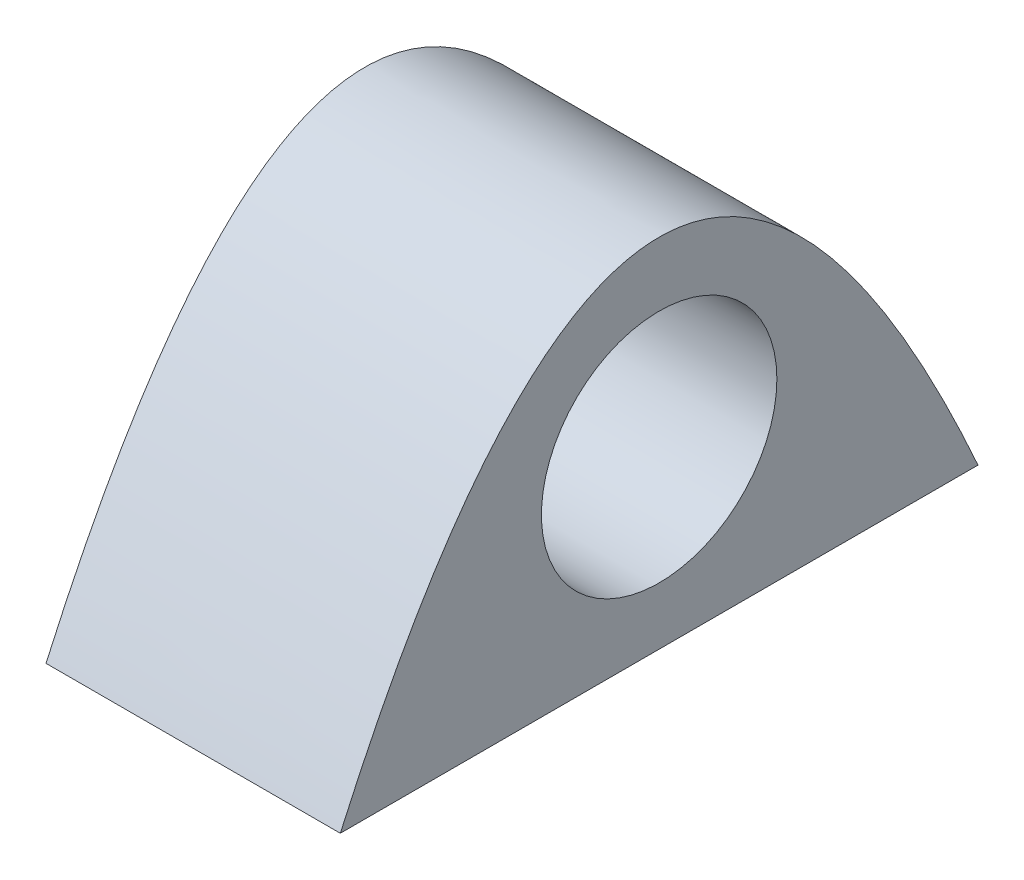
from build123d import *

# Parameters (mm, degrees)
EXTRUDE_1_DEPTH     = 3
SKETCH_2_R          = 1.2
CUT_EXTRUDE_1_DEPTH = 6.726738432


with BuildPart() as part:
    # 草图1 → 凸台-拉伸1 (new body)
    with BuildSketch(Plane(origin=(0, 0, 0), x_dir=(0, 0, -1), z_dir=(1, 0, 0))):
        with BuildLine():
            Line((-3.25, 0), (3.25, 0))
            add(Edge.make_bspline(
                [(-3.25, 0), (0, 7.275446678), (3.25, 0)],
                knots=[0, 0, 0, 1, 1, 1], degree=2))
        make_face()
    extrude(amount=EXTRUDE_1_DEPTH)

    # 草图2 → 切除-拉伸1 (cut, through all)
    with BuildSketch(Plane(origin=(3, 0, 0), x_dir=(0, 0, -1), z_dir=(1, 0, 0))):
        with Locations((0, 1.784934095)):
            Circle(SKETCH_2_R)
    extrude(amount=-CUT_EXTRUDE_1_DEPTH, mode=Mode.SUBTRACT)


solid = part.part
